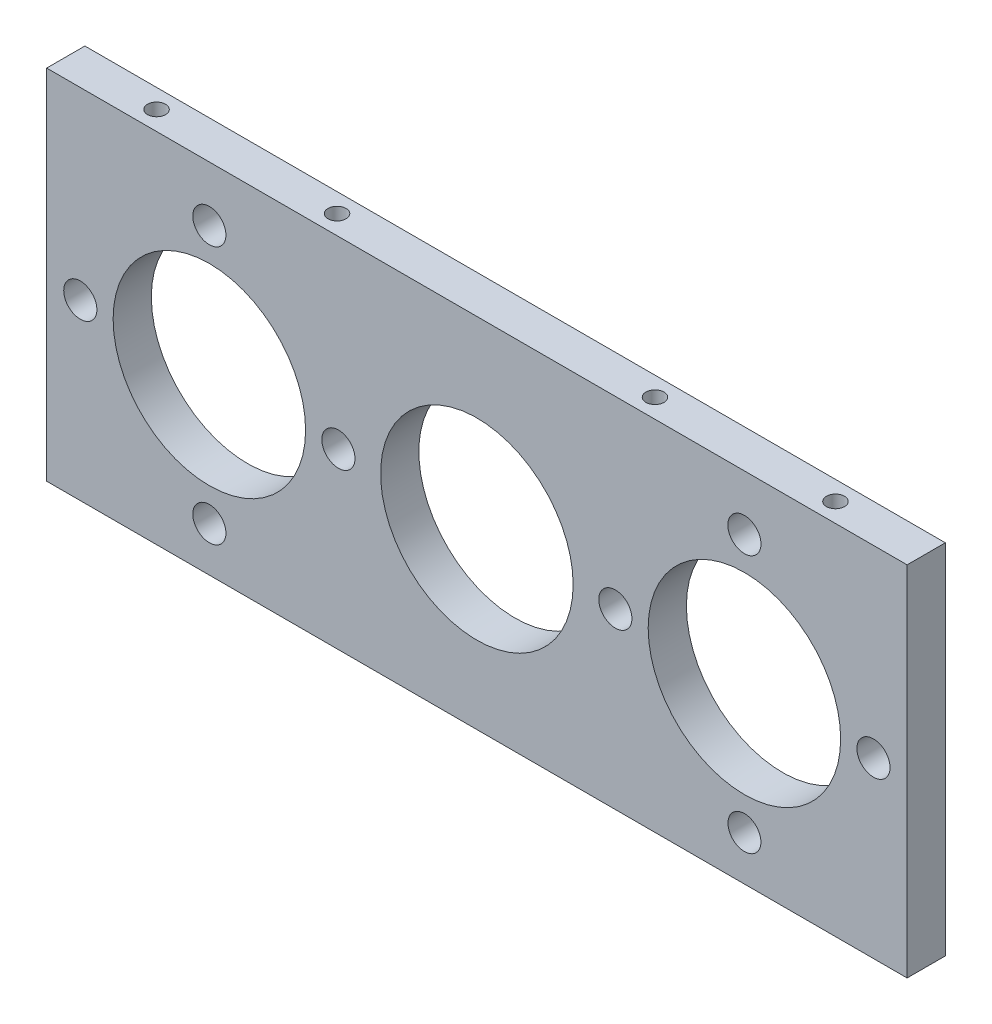
from build123d import *

# Parameters (mm, degrees)
ESBO_O1_W                = 143.01
ESBO_O1_H                = 54.05
RESSALTO_EXTRUS_O1_DEPTH = 6.35
ESBO_O2_R                = 2.755
ESBO_O2_R_2              = 2.755565393
ESBO_O2_R_3              = 2.735691737
CORTE_EXTRUS_O1_DEPTH    = 6.35
ESBO_O3_R                = 15.995
ESBO_O3_R_2              = 10
CORTE_EXTRUS_O2_DEPTH    = 10
ESBO_O4_W                = 143.01
ESBO_O4_H                = 3.42
RESSALTO_EXTRUS_O2_DEPTH = 6.35
ESBO_O5_R                = 16
CORTE_EXTRUS_O3_DEPTH    = 10
CROQUIS1_W               = 143.01
CROQUIS1_H               = 2
SALIENTE_EXTRUIR2_DEPTH  = 6.35
ESBO_O6_R                = 1.5
CORTE_EXTRUS_O4_DEPTH    = 17


with BuildPart() as part:
    # Esboço1 → Ressalto-extrusão1 (new body)
    with BuildSketch(Plane.XY):
        Rectangle(ESBO_O1_W, ESBO_O1_H)
    extrude(amount=RESSALTO_EXTRUS_O1_DEPTH)

    # Esboço2 → Corte-extrusão1 (cut)
    with BuildSketch(Plane(origin=(0, 0, 0), x_dir=(-1, 0, 0), z_dir=(0, 0, -1))):
        with Locations((-44.463136928, 23.291850449)):
            Circle(ESBO_O2_R)
        with Locations((-65.913136928, 1.841850449)):
            Circle(ESBO_O2_R_2)
        with Locations((-44.463136928, -19.608149551)):
            Circle(ESBO_O2_R_3)
        with Locations((-23.013136928, 1.841850449)):
            Circle(ESBO_O2_R)
        with Locations((23.016863072, 1.841850449)):
            Circle(ESBO_O2_R)
        with Locations((44.466863072, -19.608149551)):
            Circle(ESBO_O2_R)
        with Locations((65.916863072, 1.841850449)):
            Circle(ESBO_O2_R)
        with Locations((44.466863072, 23.291850449)):
            Circle(ESBO_O2_R)
    extrude(amount=-CORTE_EXTRUS_O1_DEPTH, mode=Mode.SUBTRACT)

    # Esboço3 → Corte-extrusão2 (cut)
    with BuildSketch(Plane(origin=(0, 0, 0), x_dir=(-1, 0, 0), z_dir=(0, 0, -1))):
        with Locations((-44.463136928, 1.841850449)):
            Circle(ESBO_O3_R)
        with Locations((0.001863072, 1.841850449)):
            Circle(ESBO_O3_R_2)
        with Locations((44.466863072, 1.841850449)):
            Circle(ESBO_O3_R)
    extrude(amount=-CORTE_EXTRUS_O2_DEPTH, mode=Mode.SUBTRACT)

    # Esboço4 → Ressalto-extrusão2 (add)
    with BuildSketch(Plane.XY):
        with Locations((0, 28.735)):
            Rectangle(ESBO_O4_W, ESBO_O4_H)
    extrude(amount=RESSALTO_EXTRUS_O2_DEPTH)

    # Esboço5 → Corte-extrusão3 (cut)
    with BuildSketch(Plane.XY.offset(6.35)):
        with Locations((-0.001863072, 1.841850449)):
            Circle(ESBO_O5_R)
    extrude(amount=-CORTE_EXTRUS_O3_DEPTH, mode=Mode.SUBTRACT)

    # Croquis1 → Saliente-Extruir2 (add)
    with BuildSketch(Plane.XY.offset(6.35)):
        with Locations((0, 31.445)):
            Rectangle(CROQUIS1_W, CROQUIS1_H)
    extrude(amount=-SALIENTE_EXTRUIR2_DEPTH)

    # Esboço6 → Corte-extrusão4 (cut)
    with BuildSketch(Plane(origin=(0, 32.445, 0), x_dir=(1, 0, 0), z_dir=(0, 1, 0))):
        with Locations(Location((56.423186497, -3.175, 0), (0, 0, 270))):
            Circle(ESBO_O6_R)
        with Locations(Location((26.423186497, -3.175, 0), (0, 0, 270))):
            Circle(ESBO_O6_R)
        with Locations(Location((-26.423186497, -3.175, 0), (0, 0, 90))):
            Circle(ESBO_O6_R)
        with Locations(Location((-56.423186497, -3.175, 0), (0, 0, 90))):
            Circle(ESBO_O6_R)
    extrude(amount=-CORTE_EXTRUS_O4_DEPTH, mode=Mode.SUBTRACT)


solid = part.part
